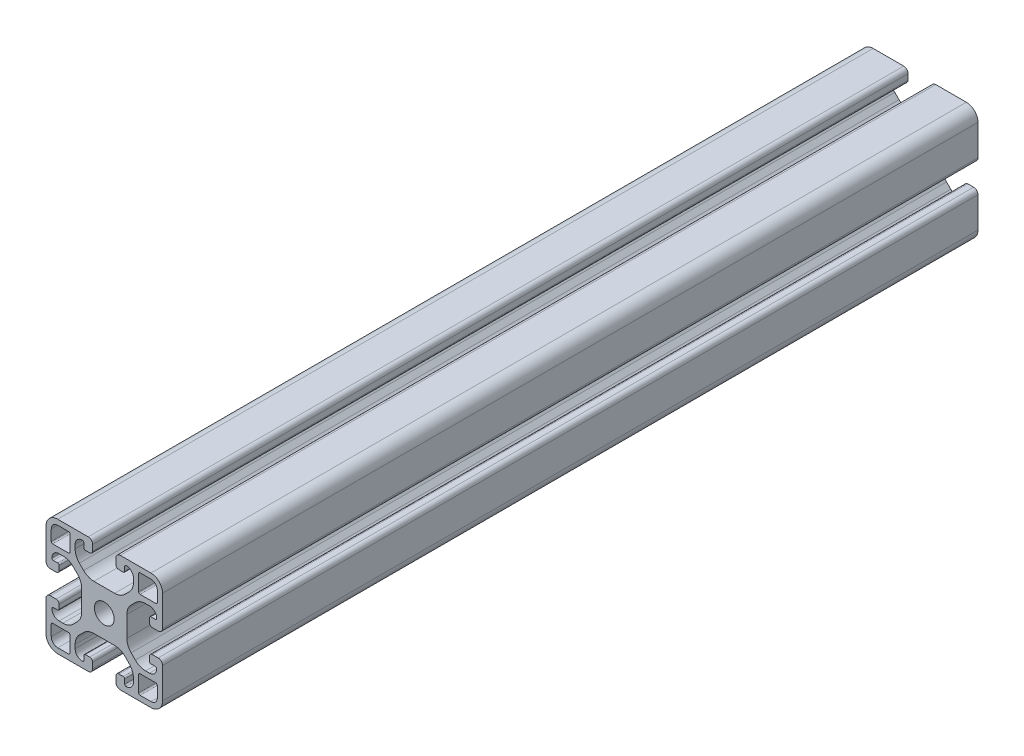
from build123d import *

# Parameters (mm, degrees)
ESQUISSE1_R        = 3.4
BOSS_EXTRU_1_DEPTH = 279.85


with BuildPart() as part:
    # Esquisse1 → Boss.-Extru.1 (new body)
    with BuildSketch(Plane(origin=(0, 0, -30), x_dir=(-1, 0, 0), z_dir=(0, 0, -1))):
        with BuildLine():
            Line((-4.5, 15), (-4.5, 13.5))
            ThreePointArc((-4.5, 13.5), (-4.353553391, 13.146446609), (-4, 13))
            Line((-4, 13), (-2.5, 13))
            ThreePointArc((-2.5, 13), (-2.146446609, 12.853553391), (-2, 12.5))
            ThreePointArc((-2, 12.5), (-2.732233047, 10.732233047), (-4.5, 10))
            Line((-4.5, 10), (-5.807611845, 10))
            ThreePointArc((-5.807611845, 10), (-7.721029006, 10.380602337), (-9.343145751, 11.464466094))
            Line((-9.343145751, 11.464466094), (-10.785533906, 12.906854249))
            ThreePointArc((-10.785533906, 12.906854249), (-11.869397663, 14.528970994), (-12.25, 16.442388155))
            Line((-12.25, 16.442388155), (-12.25, 23.557611845))
            ThreePointArc((-12.25, 23.557611845), (-11.869397663, 25.471029006), (-10.785533906, 27.093145751))
            Line((-10.785533906, 27.093145751), (-9.343145751, 28.535533906))
            ThreePointArc((-9.343145751, 28.535533906), (-7.721029006, 29.619397663), (-5.807611845, 30))
            Line((-5.807611845, 30), (-4.5, 30))
            ThreePointArc((-4.5, 30), (-2.732233047, 29.267766953), (-2, 27.5))
            ThreePointArc((-2, 27.5), (-2.146446609, 27.146446609), (-2.5, 27))
            Line((-2.5, 27), (-4, 27))
            ThreePointArc((-4, 27), (-4.353553391, 26.853553391), (-4.5, 26.5))
            Line((-4.5, 26.5), (-4.5, 25))
            ThreePointArc((-4.5, 25), (-4.207106781, 24.292893219), (-3.5, 24))
            Line((-3.5, 24), (-1.5, 24))
            ThreePointArc((-1.5, 24), (-0.439339828, 24.439339828), (0, 25.5))
            Line((0, 25.5), (0, 36))
            ThreePointArc((0, 36), (-1.171572875, 38.828427125), (-4, 40))
            Line((-4, 40), (-14.5, 40))
            ThreePointArc((-14.5, 40), (-15.560660172, 39.560660172), (-16, 38.5))
            Line((-16, 38.5), (-16, 36.5))
            ThreePointArc((-16, 36.5), (-15.707106781, 35.792893219), (-15, 35.5))
            Line((-15, 35.5), (-13.5, 35.5))
            ThreePointArc((-13.5, 35.5), (-13.146446609, 35.646446609), (-13, 36))
            Line((-13, 36), (-13, 37.5))
            ThreePointArc((-13, 37.5), (-12.853553391, 37.853553391), (-12.5, 38))
            ThreePointArc((-12.5, 38), (-10.732233047, 37.267766953), (-10, 35.5))
            Line((-10, 35.5), (-10, 34.192388155))
            ThreePointArc((-10, 34.192388155), (-10.380602337, 32.278970994), (-11.464466094, 30.656854249))
            Line((-11.464466094, 30.656854249), (-12.906854249, 29.214466094))
            ThreePointArc((-12.906854249, 29.214466094), (-14.528970994, 28.130602337), (-16.442388155, 27.75))
            Line((-16.442388155, 27.75), (-23.557611845, 27.75))
            ThreePointArc((-23.557611845, 27.75), (-25.471029006, 28.130602337), (-27.093145751, 29.214466094))
            Line((-27.093145751, 29.214466094), (-28.535533906, 30.656854249))
            ThreePointArc((-28.535533906, 30.656854249), (-29.619397663, 32.278970994), (-30, 34.192388155))
            Line((-30, 34.192388155), (-30, 35.5))
            ThreePointArc((-30, 35.5), (-29.267766953, 37.267766953), (-27.5, 38))
            ThreePointArc((-27.5, 38), (-27.146446609, 37.853553391), (-27, 37.5))
            Line((-27, 37.5), (-27, 36))
            ThreePointArc((-27, 36), (-26.853553391, 35.646446609), (-26.5, 35.5))
            Line((-26.5, 35.5), (-25, 35.5))
            ThreePointArc((-25, 35.5), (-24.292893219, 35.792893219), (-24, 36.5))
            Line((-24, 36.5), (-24, 38.5))
            ThreePointArc((-24, 38.5), (-24.439339828, 39.560660172), (-25.5, 40))
            Line((-25.5, 40), (-36, 40))
            ThreePointArc((-36, 40), (-38.828427125, 38.828427125), (-40, 36))
            Line((-40, 36), (-40, 25.5))
            ThreePointArc((-40, 25.5), (-39.560660172, 24.439339828), (-38.5, 24))
            Line((-38.5, 24), (-36.5, 24))
            ThreePointArc((-36.5, 24), (-35.792893219, 24.292893219), (-35.5, 25))
            Line((-35.5, 25), (-35.5, 26.5))
            ThreePointArc((-35.5, 26.5), (-35.646446609, 26.853553391), (-36, 27))
            Line((-36, 27), (-37.5, 27))
            ThreePointArc((-37.5, 27), (-37.853553391, 27.146446609), (-38, 27.5))
            ThreePointArc((-38, 27.5), (-37.267766953, 29.267766953), (-35.5, 30))
            Line((-35.5, 30), (-34.192388155, 30))
            ThreePointArc((-34.192388155, 30), (-32.278970994, 29.619397663), (-30.656854249, 28.535533906))
            Line((-30.656854249, 28.535533906), (-29.214466094, 27.093145751))
            ThreePointArc((-29.214466094, 27.093145751), (-28.130602337, 25.471029006), (-27.75, 23.557611845))
            Line((-27.75, 23.557611845), (-27.75, 16.442388155))
            ThreePointArc((-27.75, 16.442388155), (-28.130602337, 14.528970994), (-29.214466094, 12.906854249))
            Line((-29.214466094, 12.906854249), (-30.656854249, 11.464466094))
            ThreePointArc((-30.656854249, 11.464466094), (-32.278970994, 10.380602337), (-34.192388155, 10))
            Line((-34.192388155, 10), (-35.5, 10))
            ThreePointArc((-35.5, 10), (-37.267766953, 10.732233047), (-38, 12.5))
            ThreePointArc((-38, 12.5), (-37.853553391, 12.853553391), (-37.5, 13))
            Line((-37.5, 13), (-36, 13))
            ThreePointArc((-36, 13), (-35.646446609, 13.146446609), (-35.5, 13.5))
            Line((-35.5, 13.5), (-35.5, 15))
            ThreePointArc((-35.5, 15), (-35.792893219, 15.707106781), (-36.5, 16))
            Line((-36.5, 16), (-38.5, 16))
            ThreePointArc((-38.5, 16), (-39.560660172, 15.560660172), (-40, 14.5))
            Line((-40, 14.5), (-40, 4))
            ThreePointArc((-40, 4), (-38.828427125, 1.171572875), (-36, 0))
            Line((-36, 0), (-25.5, 0))
            ThreePointArc((-25.5, 0), (-24.439339828, 0.439339828), (-24, 1.5))
            Line((-24, 1.5), (-24, 3.5))
            ThreePointArc((-24, 3.5), (-24.292893219, 4.207106781), (-25, 4.5))
            Line((-25, 4.5), (-26.5, 4.5))
            ThreePointArc((-26.5, 4.5), (-26.853553391, 4.353553391), (-27, 4))
            Line((-27, 4), (-27, 2.5))
            ThreePointArc((-27, 2.5), (-27.146446609, 2.146446609), (-27.5, 2))
            ThreePointArc((-27.5, 2), (-29.267766953, 2.732233047), (-30, 4.5))
            Line((-30, 4.5), (-30, 5.807611845))
            ThreePointArc((-30, 5.807611845), (-29.619397663, 7.721029006), (-28.535533906, 9.343145751))
            Line((-28.535533906, 9.343145751), (-27.093145751, 10.785533906))
            ThreePointArc((-27.093145751, 10.785533906), (-25.471029006, 11.869397663), (-23.557611845, 12.25))
            Line((-23.557611845, 12.25), (-16.442388155, 12.25))
            ThreePointArc((-16.442388155, 12.25), (-14.528970994, 11.869397663), (-12.906854249, 10.785533906))
            Line((-12.906854249, 10.785533906), (-11.464466094, 9.343145751))
            ThreePointArc((-11.464466094, 9.343145751), (-10.380602337, 7.721029006), (-10, 5.807611845))
            Line((-10, 5.807611845), (-10, 4.5))
            ThreePointArc((-10, 4.5), (-10.732233047, 2.732233047), (-12.5, 2))
            ThreePointArc((-12.5, 2), (-12.853553391, 2.146446609), (-13, 2.5))
            Line((-13, 2.5), (-13, 4))
            ThreePointArc((-13, 4), (-13.146446609, 4.353553391), (-13.5, 4.5))
            Line((-13.5, 4.5), (-15, 4.5))
            ThreePointArc((-15, 4.5), (-15.707106781, 4.207106781), (-16, 3.5))
            Line((-16, 3.5), (-16, 1.5))
            ThreePointArc((-16, 1.5), (-15.560660172, 0.439339828), (-14.5, 0))
            Line((-14.5, 0), (-4, 0))
            ThreePointArc((-4, 0), (-1.171572875, 1.171572875), (0, 4))
            Line((0, 4), (0, 14.5))
            ThreePointArc((0, 14.5), (-0.439339828, 15.560660172), (-1.5, 16))
            Line((-1.5, 16), (-3.5, 16))
            ThreePointArc((-3.5, 16), (-4.207106781, 15.707106781), (-4.5, 15))
        make_face()
        with Locations(Location((-20, 20, 0), (0, 0, 180))):
            Circle(ESQUISSE1_R, mode=Mode.SUBTRACT)
        with BuildLine():
            Line((-4, 1.8), (-7.7, 1.8))
            ThreePointArc((-7.7, 1.8), (-8.053553391, 1.946446609), (-8.2, 2.3))
            Line((-8.2, 2.3), (-8.2, 7.7))
            ThreePointArc((-8.2, 7.7), (-8.053553391, 8.053553391), (-7.7, 8.2))
            Line((-7.7, 8.2), (-2.3, 8.2))
            ThreePointArc((-2.3, 8.2), (-1.946446609, 8.053553391), (-1.8, 7.7))
            Line((-1.8, 7.7), (-1.8, 4))
            ThreePointArc((-1.8, 4), (-2.444365081, 2.444365081), (-4, 1.8))
        make_face(mode=Mode.SUBTRACT)
        with BuildLine():
            Line((-38.2, 4), (-38.2, 7.7))
            ThreePointArc((-38.2, 7.7), (-38.053553391, 8.053553391), (-37.7, 8.2))
            Line((-37.7, 8.2), (-32.3, 8.2))
            ThreePointArc((-32.3, 8.2), (-31.946446609, 8.053553391), (-31.8, 7.7))
            Line((-31.8, 7.7), (-31.8, 2.3))
            ThreePointArc((-31.8, 2.3), (-31.946446609, 1.946446609), (-32.3, 1.8))
            Line((-32.3, 1.8), (-36, 1.8))
            ThreePointArc((-36, 1.8), (-37.555634919, 2.444365081), (-38.2, 4))
        make_face(mode=Mode.SUBTRACT)
        with BuildLine():
            Line((-36, 38.2), (-32.3, 38.2))
            ThreePointArc((-32.3, 38.2), (-31.946446609, 38.053553391), (-31.8, 37.7))
            Line((-31.8, 37.7), (-31.8, 32.3))
            ThreePointArc((-31.8, 32.3), (-31.946446609, 31.946446609), (-32.3, 31.8))
            Line((-32.3, 31.8), (-37.7, 31.8))
            ThreePointArc((-37.7, 31.8), (-38.053553391, 31.946446609), (-38.2, 32.3))
            Line((-38.2, 32.3), (-38.2, 36))
            ThreePointArc((-38.2, 36), (-37.555634919, 37.555634919), (-36, 38.2))
        make_face(mode=Mode.SUBTRACT)
        with BuildLine():
            Line((-1.8, 36), (-1.8, 32.3))
            ThreePointArc((-1.8, 32.3), (-1.946446609, 31.946446609), (-2.3, 31.8))
            Line((-2.3, 31.8), (-7.7, 31.8))
            ThreePointArc((-7.7, 31.8), (-8.053553391, 31.946446609), (-8.2, 32.3))
            Line((-8.2, 32.3), (-8.2, 37.7))
            ThreePointArc((-8.2, 37.7), (-8.053553391, 38.053553391), (-7.7, 38.2))
            Line((-7.7, 38.2), (-4, 38.2))
            ThreePointArc((-4, 38.2), (-2.444365081, 37.555634919), (-1.8, 36))
        make_face(mode=Mode.SUBTRACT)
    extrude(amount=-BOSS_EXTRU_1_DEPTH)


solid = part.part
